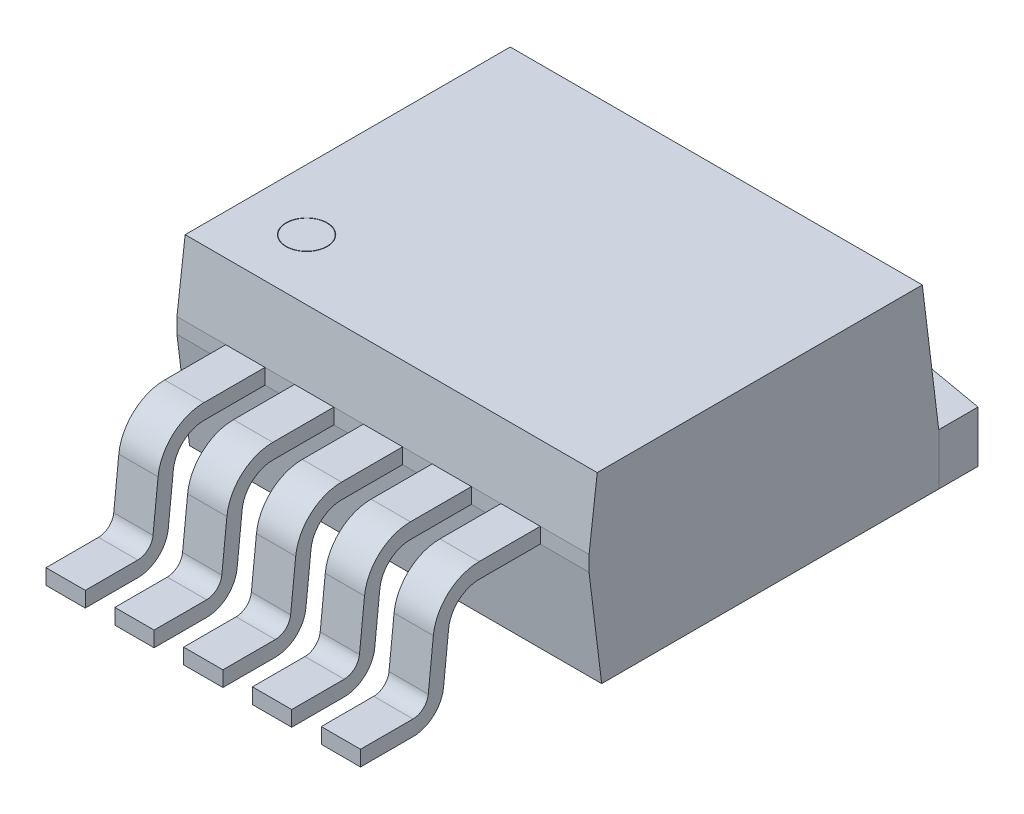
from build123d import *

# Parameters (mm, degrees)
EXTRUDE_1_DEPTH            = 1.27
EXTRUDE_2_DEPTH            = 0.01
EXTRUDE_2_DEPTH_BACK       = 10.17
SKETCH_4_R                 = 0.51
SKETCH_4_R_2               = 0.5
CUT_EXTRUDE_1_DEPTH        = 0.1
EXTRUDE_3_DEPTH            = 0.485
PATTERN_LINEAR_1_COUNT     = 3
PATTERN_LINEAR_1_PITCH     = 1.7
PATTERN_LINEAR_1_COL_COUNT = 3
PATTERN_LINEAR_1_COL_PITCH = 1.7


with BuildPart() as part:
    # Эскиз2 → Бобышка-Вытянуть1 (new body)
    with BuildSketch(Plane(origin=(0, 0, 0), x_dir=(1, 0, 0), z_dir=(0, 1, 0))):
        Polygon((3.43, 6.35), (5.08, 6.059060482), (5.08, 5.08), (2.9, 5.08), (2.9, 0), (-2.9, 0), (-2.9, 5.08), (-5.08, 5.08), (-5.08, 6.059060482), (-3.43, 6.35), align=None)
    extrude(amount=EXTRUDE_1_DEPTH)

    # Эскиз3 → Бобышка-Вытянуть2 (add, two sides: drawn at the far end of the back side and taken through both)
    with BuildSketch(Plane.ZY.offset(5.08).offset(-EXTRUDE_2_DEPTH_BACK)):
        Polygon((-5.08, 0.01), (-5.08, 1.27), (-4.673583103, 4.58), (3.357405475, 4.58), (3.56, 2.93), (3.56, 2.55), (3.248127215, 0.01), align=None)
    extrude(amount=EXTRUDE_2_DEPTH + EXTRUDE_2_DEPTH_BACK)

    # Эскиз4 → Вырез-Вытянуть1 (cut)
    with BuildSketch(Plane(origin=(0, 4.58, 0), x_dir=(1, 0, 0), z_dir=(0, 1, 0))):
        with Locations(Location((-3.59, -1.857405475, 0), (0, 0, 270))):
            Circle(SKETCH_4_R)
        with Locations(Location((-3.59, -1.857405475, 0), (0, 0, 270))):
            Circle(SKETCH_4_R_2, mode=Mode.SUBTRACT)
    extrude(amount=-CUT_EXTRUDE_1_DEPTH, mode=Mode.SUBTRACT)

    # Эскиз5 → Бобышка-Вытянуть3 (add, symmetric)
    with BuildSketch(Plane(origin=(0, 0, 0), x_dir=(0, 0, -1), z_dir=(1, 0, 0))):
        with BuildLine():
            Line((-3.56, 2.93), (-3.56, 2.55))
            Line((-3.56, 2.55), (-5.067677126, 2.55))
            ThreePointArc((-5.067677126, 2.55), (-5.576216387, 2.354790067), (-5.823513767, 1.869441632))
            Line((-5.823513767, 1.869441632), (-5.948470433, 0.680558368))
            ThreePointArc((-5.948470433, 0.680558368), (-6.195767813, 0.195209933), (-6.704307074, 0))
            Line((-6.704307074, 0), (-8, 0))
            Line((-8, 0), (-8, 0.38))
            Line((-8, 0.38), (-6.704307074, 0.38))
            ThreePointArc((-6.704307074, 0.38), (-6.450037443, 0.477604966), (-6.326388753, 0.720279184))
            Line((-6.326388753, 0.720279184), (-6.201432087, 1.909162448))
            ThreePointArc((-6.201432087, 1.909162448), (-5.830486018, 2.637185101), (-5.067677126, 2.93))
            Line((-5.067677126, 2.93), (-3.56, 2.93))
        make_face()
    extrude_3 = extrude(amount=EXTRUDE_3_DEPTH, both=True)

    # Линейный массив1: Бобышка-Вытянуть3 ×3
    with Locations(*[(-i * PATTERN_LINEAR_1_PITCH, 0, 0) for i in range(1, PATTERN_LINEAR_1_COUNT)]):
        add(extrude_3)

    # Линейный массив1 col: Бобышка-Вытянуть3 ×3
    with Locations(*[(i * PATTERN_LINEAR_1_COL_PITCH, 0, 0) for i in range(1, PATTERN_LINEAR_1_COL_COUNT)]):
        add(extrude_3)


solid = part.part
